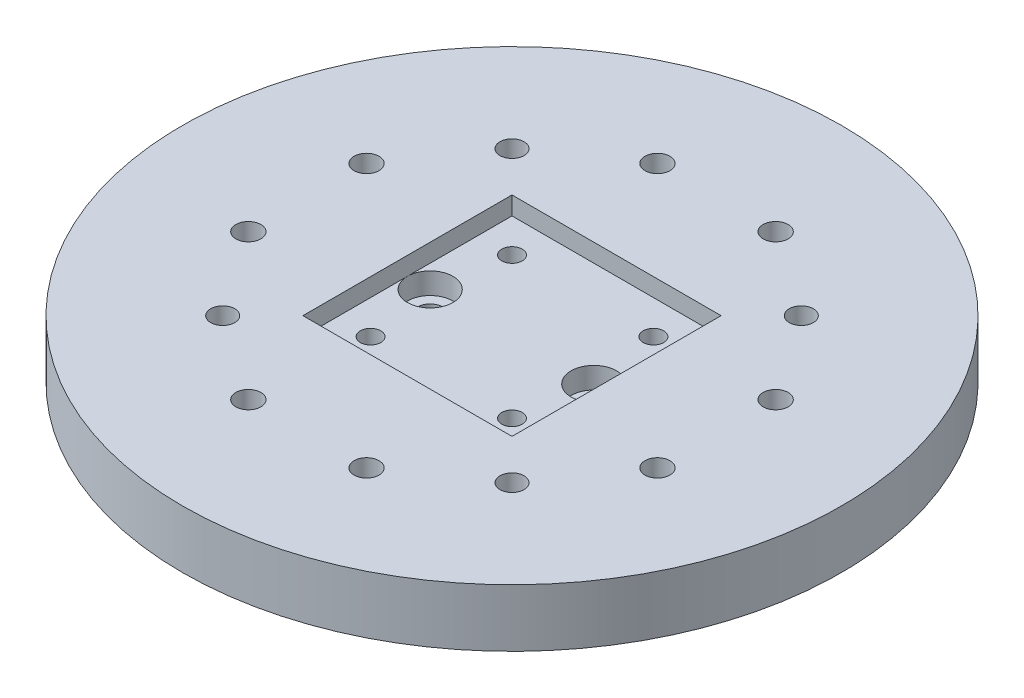
from build123d import *

# Parameters (mm, degrees)
SKETCH1_R           = 72.5
BOSS_EXTRUDE1_DEPTH = 12.7
SKETCH2_R           = 2.65
CUT_EXTRUDE1_DEPTH  = 104.314035833
SKETCH3_R           = 5
CUT_EXTRUDE2_DEPTH  = 5
SKETCH4_R           = 2.75
CUT_EXTRUDE3_DEPTH  = 104.314035833
SKETCH7_W           = 46
SKETCH7_H           = 46
CUT_EXTRUDE6_DEPTH  = 4
SKETCH8_R           = 2.25
CUT_EXTRUDE7_DEPTH  = 103.898930995
SKETCH9_R           = 2.75
CUT_EXTRUDE8_DEPTH  = 104.314035833
SKETCH10_R          = 5
CUT_EXTRUDE9_DEPTH  = 4.7


with BuildPart() as part:
    # Sketch1 → Boss-Extrude1 (new body)
    with BuildSketch(Plane(origin=(0, 0, 0), x_dir=(1, 0, 0), z_dir=(0, 1, 0))):
        with Locations(Location((0, 0, 0), (0, 0, 270))):
            Circle(SKETCH1_R)
    extrude(amount=BOSS_EXTRUDE1_DEPTH)

    # Sketch2 → Cut-Extrude1 (cut, through all)
    with BuildSketch(Plane.XZ):
        with Locations(Location((31.819805153, 31.819805153, 0), (0, 0, 270))):
            Circle(SKETCH2_R)
        with Locations(Location((31.819805153, -31.819805153, 0), (0, 0, 270))):
            Circle(SKETCH2_R)
        with Locations(Location((-31.819805153, -31.819805153, 0), (0, 0, 270))):
            Circle(SKETCH2_R)
        with Locations(Location((-31.819805153, 31.819805153, 0), (0, 0, 270))):
            Circle(SKETCH2_R)
    extrude(amount=-CUT_EXTRUDE1_DEPTH, mode=Mode.SUBTRACT)

    # Sketch3 → Cut-Extrude2 (cut)
    with BuildSketch(Plane.XZ):
        with Locations(Location((-31.819805153, 31.819805153, 0), (0, 0, 270))):
            Circle(SKETCH3_R)
        with Locations(Location((31.819805153, 31.819805153, 0), (0, 0, 270))):
            Circle(SKETCH3_R)
        with Locations(Location((31.819805153, -31.819805153, 0), (0, 0, 270))):
            Circle(SKETCH3_R)
        with Locations(Location((-31.819805153, -31.819805153, 0), (0, 0, 270))):
            Circle(SKETCH3_R)
    extrude(amount=-CUT_EXTRUDE2_DEPTH, mode=Mode.SUBTRACT)

    # Sketch4 → Cut-Extrude3 (cut, through all)
    with BuildSketch(Plane.XZ):
        with Locations(Location((13, 45, 0), (0, 0, 270))):
            Circle(SKETCH4_R)
        with Locations(Location((-13, 45, 0), (0, 0, 90))):
            Circle(SKETCH4_R)
        with Locations(Location((45, -13, 0), (0, 0, 270))):
            Circle(SKETCH4_R)
        with Locations(Location((45, 13, 0), (0, 0, 90))):
            Circle(SKETCH4_R)
        with Locations(Location((-13, -45, 0), (0, 0, 270))):
            Circle(SKETCH4_R)
        with Locations(Location((13, -45, 0), (0, 0, 90))):
            Circle(SKETCH4_R)
        with Locations(Location((-45, 13, 0), (0, 0, 270))):
            Circle(SKETCH4_R)
        with Locations(Location((-45, -13, 0), (0, 0, 90))):
            Circle(SKETCH4_R)
    extrude(amount=-CUT_EXTRUDE3_DEPTH, mode=Mode.SUBTRACT)

    # Sketch7 → Cut-Extrude6 (cut)
    with BuildSketch(Plane(origin=(0, 12.7, 0), x_dir=(1, 0, 0), z_dir=(0, 1, 0))):
        Rectangle(SKETCH7_W, SKETCH7_H)
    extrude(amount=-CUT_EXTRUDE6_DEPTH, mode=Mode.SUBTRACT)

    # Sketch8 → Cut-Extrude7 (cut, through all)
    with BuildSketch(Plane(origin=(0, 8.7, 0), x_dir=(1, 0, 0), z_dir=(0, 1, 0))):
        with Locations(Location((15.556349186, 15.556349186, 0), (0, 0, 270))):
            Circle(SKETCH8_R)
        with Locations(Location((-15.556349186, 15.556349186, 0), (0, 0, 90))):
            Circle(SKETCH8_R)
        with Locations(Location((15.556349186, -15.556349186, 0), (0, 0, 90))):
            Circle(SKETCH8_R)
        with Locations(Location((-15.556349186, -15.556349186, 0), (0, 0, 270))):
            Circle(SKETCH8_R)
    extrude(amount=-CUT_EXTRUDE7_DEPTH, mode=Mode.SUBTRACT)

    # Sketch9 → Cut-Extrude8 (cut, through all)
    with BuildSketch(Plane.XZ):
        with Locations(Location((18, 0, 0), (0, 0, 270))):
            Circle(SKETCH9_R)
        with Locations(Location((-18, 0, 0), (0, 0, 90))):
            Circle(SKETCH9_R)
    extrude(amount=-CUT_EXTRUDE8_DEPTH, mode=Mode.SUBTRACT)

    # Sketch10 → Cut-Extrude9 (cut)
    with BuildSketch(Plane(origin=(0, 8.7, 0), x_dir=(1, 0, 0), z_dir=(0, 1, 0))):
        with Locations(Location((-18, 0, 0), (0, 0, 270))):
            Circle(SKETCH10_R)
        with Locations(Location((18, 0, 0), (0, 0, 270))):
            Circle(SKETCH10_R)
    extrude(amount=-CUT_EXTRUDE9_DEPTH, mode=Mode.SUBTRACT)


solid = part.part
